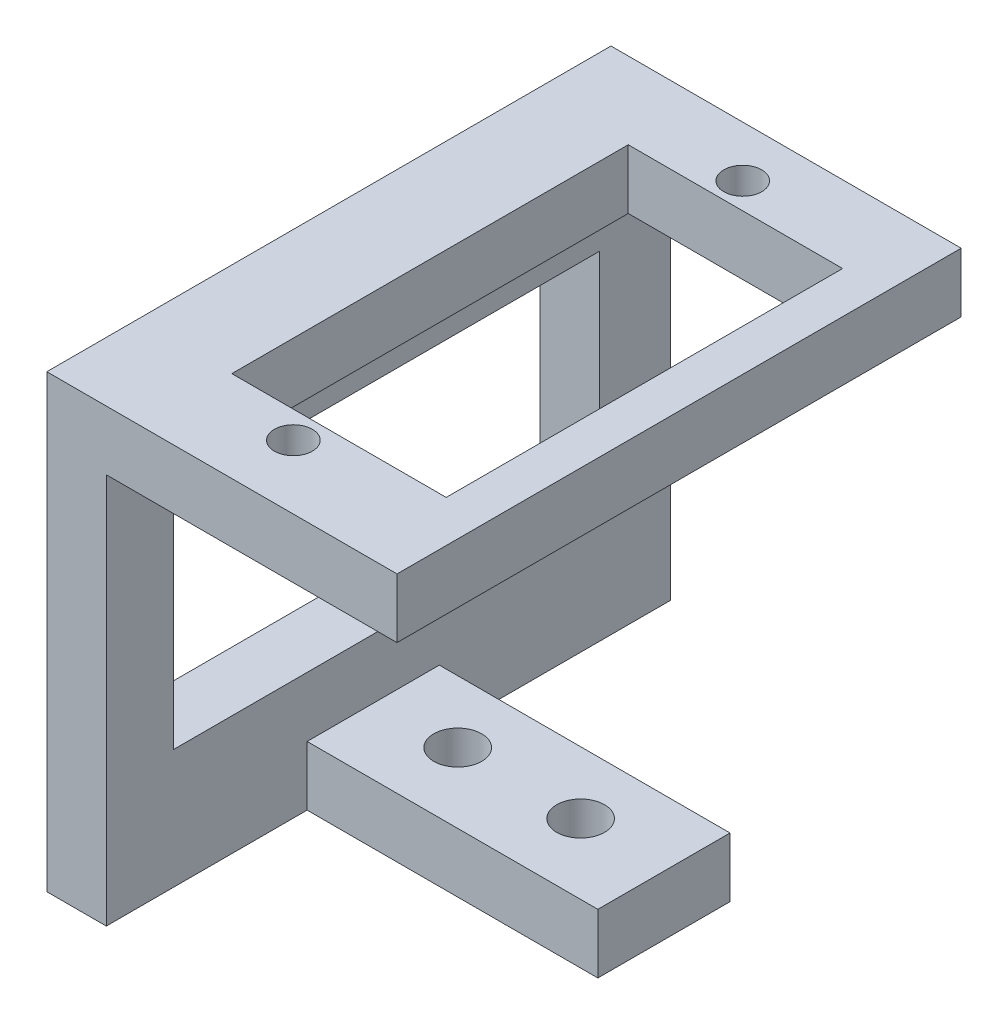
from build123d import *

# Parameters (mm, degrees)
EXTRUDE_THIN1_DEPTH = 34.154055886
SKETCH5_R           = 1.15
SKETCH5_W           = 12.978284002
SKETCH5_H           = 24
CUT_EXTRUDE7_DEPTH  = 8
SKETCH6_W           = 17.6
SKETCH6_H           = 13.993236592
SKETCH6_H_2         = 12.157086016
CUT_EXTRUDE8_DEPTH  = 29
SKETCH7_R           = 1.45
CUT_EXTRUDE9_DEPTH  = 33
SKETCH8_W           = 25.782103653
SKETCH8_H           = 13.229301
CUT_EXTRUDE10_DEPTH = 16


with BuildPart() as part:
    # Sketch1 → Extrude-Thin1 (new body)
    with BuildSketch(Plane.XY):
        Polygon((17.6, 0), (0, 0), (0, -20.0603024), (17.6, -20.0603024), (17.6, -23.662253526), (-3.601951126, -23.662253526), (-3.601951126, 3.601951126), (17.6, 3.601951126), align=None)
    extrude(amount=-EXTRUDE_THIN1_DEPTH)

    # Sketch5 → Cut-Extrude7 (cut)
    with BuildSketch(Plane(origin=(0, 0, 0), x_dir=(1, 0, 0), z_dir=(0, 1, 0))):
        with Locations(Location((7.452972893, 31.077545708, 0), (0, 0, 270))):
            Circle(SKETCH5_R)
        with Locations(Location((7.452972893, 3.870616702, 0), (0, 0, 270))):
            Circle(SKETCH5_R)
        with Locations((8.587190875, 17.5)):
            Rectangle(SKETCH5_W, SKETCH5_H)
    extrude(amount=CUT_EXTRUDE7_DEPTH, mode=Mode.SUBTRACT)

    # Sketch6 → Cut-Extrude8 (cut)
    with BuildSketch(Plane(origin=(0, 0, 0), x_dir=(1, 0, 0), z_dir=(0, 1, 0))):
        with Locations((8.8, 27.15743759)):
            Rectangle(SKETCH6_W, SKETCH6_H)
        with Locations((8.8, 6.078543008)):
            Rectangle(SKETCH6_W, SKETCH6_H_2)
    extrude(amount=-CUT_EXTRUDE8_DEPTH, mode=Mode.SUBTRACT)

    # Sketch7 → Cut-Extrude9 (cut)
    with BuildSketch(Plane(origin=(0, 0, 0), x_dir=(1, 0, 0), z_dir=(0, 1, 0))):
        with Locations(Location((4.880389158, 16.394356575, 0), (0, 0, 90))):
            Circle(SKETCH7_R)
        with Locations(Location((12.319153027, 16.394356575, 0), (0, 0, 90))):
            Circle(SKETCH7_R)
    extrude(amount=-CUT_EXTRUDE9_DEPTH, mode=Mode.SUBTRACT)

    # Sketch8 → Cut-Extrude10 (cut)
    with BuildSketch(Plane(origin=(0, 0, 0), x_dir=(0, 0, -1), z_dir=(1, 0, 0))):
        with Locations((16.964278219, -9.823443372)):
            Rectangle(SKETCH8_W, SKETCH8_H)
    extrude(amount=-CUT_EXTRUDE10_DEPTH, mode=Mode.SUBTRACT)


solid = part.part
